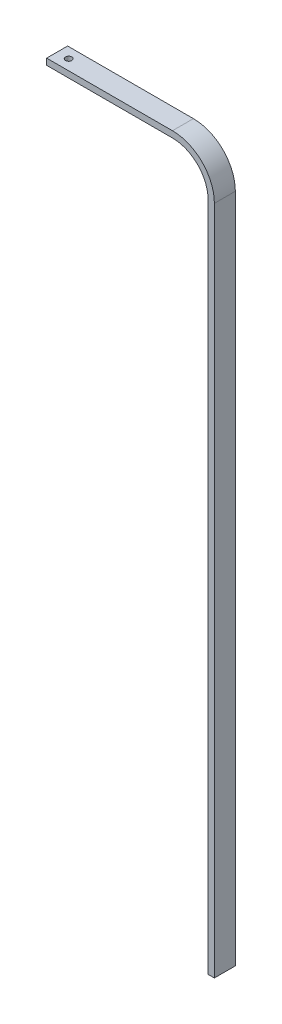
from build123d import *

# Parameters (mm, degrees)
BOSS_EXTRUDE1_DEPTH = 10
SKETCH2_R           = 1.5
CUT_EXTRUDE1_DEPTH  = 5


with BuildPart() as part:
    # Sketch1 → Boss-Extrude1 (new body)
    with BuildSketch(Plane.XY):
        with BuildLine():
            Line((20, 0), (20, -320))
            Line((20, -320), (17, -320))
            Line((17, -320), (17, 0))
            ThreePointArc((17, 0), (12.02081528, 12.02081528), (0, 17))
            Line((0, 17), (-60, 17))
            Line((-60, 17), (-60, 20))
            Line((-60, 20), (0, 20))
            ThreePointArc((0, 20), (14.142135624, 14.142135624), (20, 0))
        make_face()
    extrude(amount=BOSS_EXTRUDE1_DEPTH)

    # Sketch2 → Cut-Extrude1 (cut)
    with BuildSketch(Plane(origin=(0, 20, 0), x_dir=(1, 0, 0), z_dir=(0, 1, 0))):
        with Locations(Location((-54.5, -5, 0), (0, 0, 180))):
            Circle(SKETCH2_R)
    extrude(amount=-CUT_EXTRUDE1_DEPTH, mode=Mode.SUBTRACT)


solid = part.part
